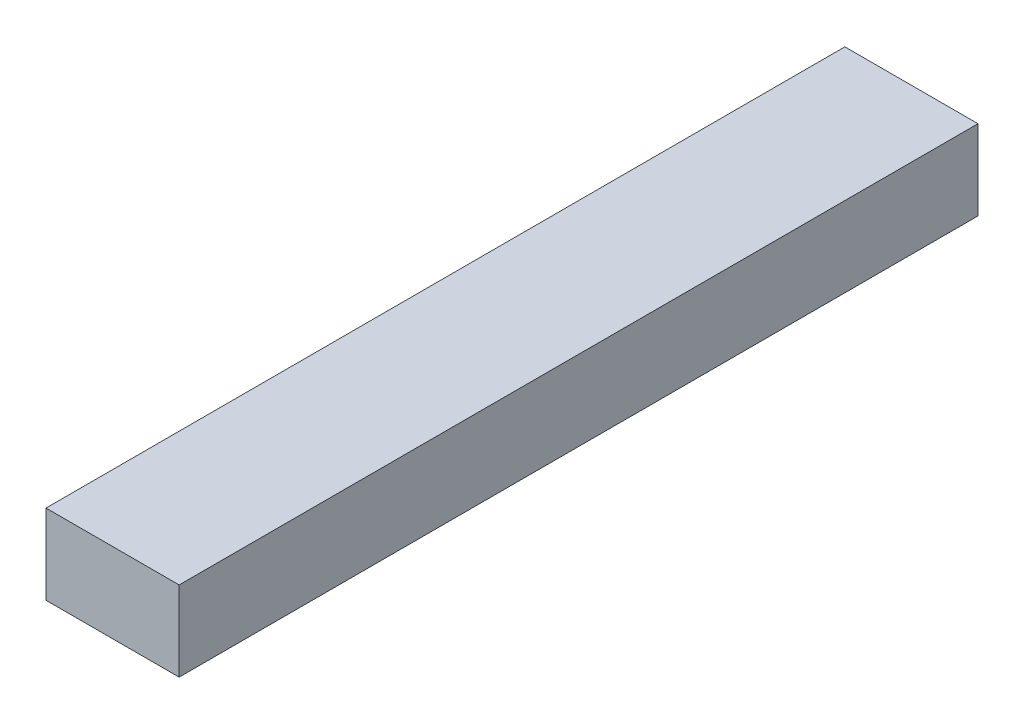
from build123d import *

# Parameters (mm, degrees)
SKETCH1_W           = 63.5
SKETCH1_H           = 38.1
BOSS_EXTRUDE1_DEPTH = 190.5


with BuildPart() as part:
    # Sketch1 → Boss-Extrude1 (new, symmetric)
    with BuildSketch(Plane.XY):
        Rectangle(SKETCH1_W, SKETCH1_H)
    extrude(amount=BOSS_EXTRUDE1_DEPTH, both=True)


solid = part.part
